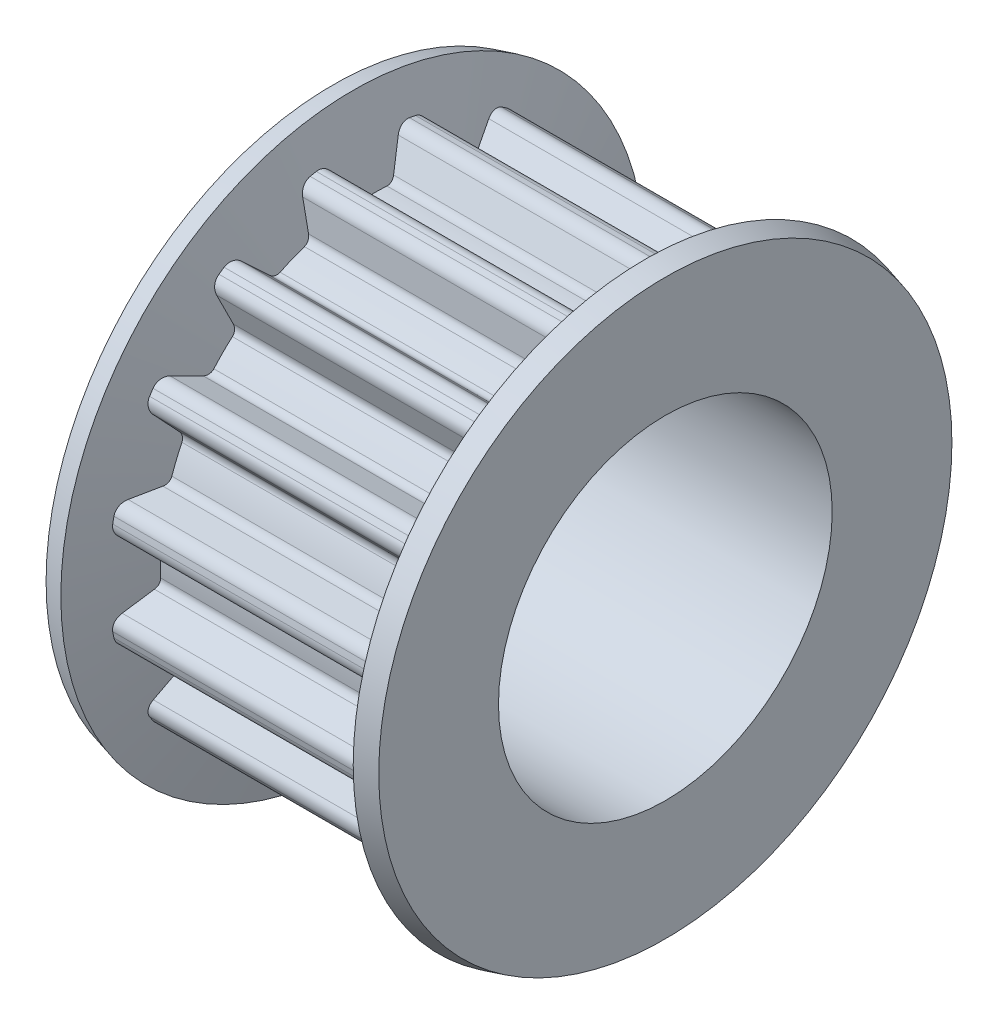
from build123d import *

# Parameters (mm, degrees)
SKETCH2_W         = 7.75
SKETCH2_H         = 6.1
COG_DEPTH         = 12.596659002
PATTERN_COG_COUNT = 16
SKETCH8_W         = 17.303989153
SKETCH8_H         = 4


with BuildPart() as part:
    # Sketch2 → Body (revolve)
    with BuildSketch(Plane.XY, mode=Mode.PRIVATE) as body_sk:
        with Locations((3.875, 3.05)):
            Rectangle(SKETCH2_W, SKETCH2_H)
    revolve(body_sk.sketch.rotate(Axis((0, 0, 0), (1, 0, 0)), 90), axis=Axis((0, 0, 0), (1, 0, 0)))

    # Sketch6 → Cog (cut, through all)
    with BuildSketch(Plane(origin=(0, 0, 0), x_dir=(0, 0, -1), z_dir=(1, 0, 0))):
        with BuildLine():
            Line((0.789835397, 5.82877936), (0.508392514, 5.225223151))
            ThreePointArc((0.508392514, 5.225223151), (0.429351309, 5.137842761), (0.314832372, 5.1101253))
            ThreePointArc((0.314832372, 5.1101253), (0, 5.11981445), (-0.314832372, 5.1101253))
            ThreePointArc((-0.314832372, 5.1101253), (-0.429351309, 5.137842761), (-0.508392514, 5.225223151))
            Line((-0.508392514, 5.225223151), (-0.789835397, 5.82877936))
            ThreePointArc((-0.789835397, 5.82877936), (-0.924476923, 5.968756351), (-1.116644684, 5.996924599))
            ThreePointArc((-1.116644684, 5.996924599), (0, 6.1), (1.116644684, 5.996924599))
            ThreePointArc((1.116644684, 5.996924599), (0.924476923, 5.968756351), (0.789835397, 5.82877936))
        make_face()
    cog = extrude(amount=COG_DEPTH, mode=Mode.SUBTRACT)

    # Pattern-Cog: Cog ×16 about axis
    pattern_cog_axis = Axis((0, 0, 0), (1, 0, 0))
    for i in range(1, PATTERN_COG_COUNT):
        add(cog.rotate(pattern_cog_axis, i * 360 / PATTERN_COG_COUNT), mode=Mode.SUBTRACT)

    # Sketch16 → Flange-Left (revolve)
    with BuildSketch(Plane.XY, mode=Mode.PRIVATE) as flange_left_sk:
        Polygon((-0.112669074, 6.870590477), (-0.112669074, 2.542315139), (1.426148407, 2.542315139), (1.426148407, 3.059497106), (0.370293839, 7), align=None)
    revolve(flange_left_sk.sketch.rotate(Axis((0, 0, 0), (1, 0, 0)), 90), axis=Axis((0, 0, 0), (1, 0, 0)))

    # Sketch17 → Flange-Right (revolve)
    with BuildSketch(Plane.XY, mode=Mode.PRIVATE) as flange_right_sk:
        Polygon((7.862669074, 6.870590477), (7.862669074, 2.542315139), (6.906696165, 2.542315139), (6.906696165, 5.234702663), (7.379706161, 7), align=None)
    revolve(flange_right_sk.sketch.rotate(Axis((0, 0, 0), (1, 0, 0)), 90), axis=Axis((0, 0, 0), (1, 0, 0)))

    # Sketch8 → Hole-Shaft (revolve, cut)
    with BuildSketch(Plane.XY, mode=Mode.PRIVATE) as hole_shaft_sk:
        with Locations((7.348005424, -2)):
            Rectangle(SKETCH8_W, SKETCH8_H)
    revolve(hole_shaft_sk.sketch.rotate(Axis((-1.303989153, 0, 0), (1, 0, 0)), 84.509344287), axis=Axis((-1.303989153, 0, 0), (1, 0, 0)), mode=Mode.SUBTRACT)


solid = part.part
